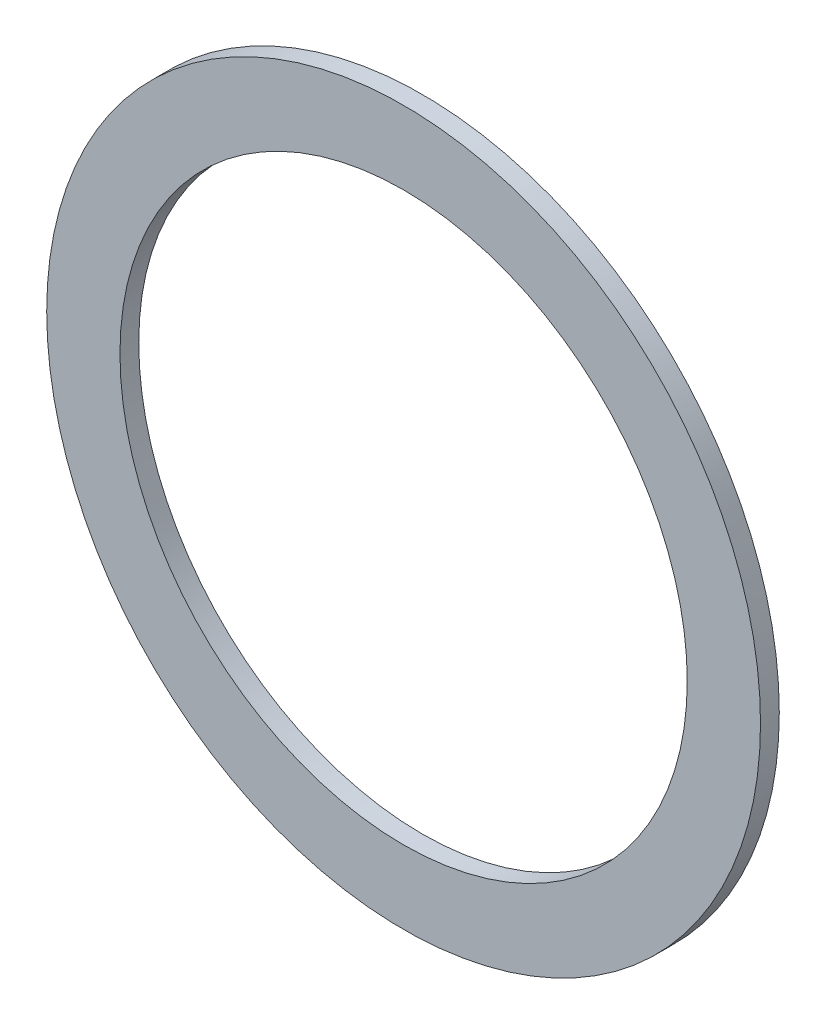
from build123d import *

# Parameters (mm, degrees)
SKETCH1_R           = 19
SKETCH1_R_2         = 15.1
BOSS_EXTRUDE1_DEPTH = 0.5


with BuildPart() as part:
    # Sketch1 → Boss-Extrude1 (new, symmetric)
    with BuildSketch(Plane.XY):
        Circle(SKETCH1_R)
        Circle(SKETCH1_R_2, mode=Mode.SUBTRACT)
    extrude(amount=BOSS_EXTRUDE1_DEPTH, both=True)


solid = part.part
